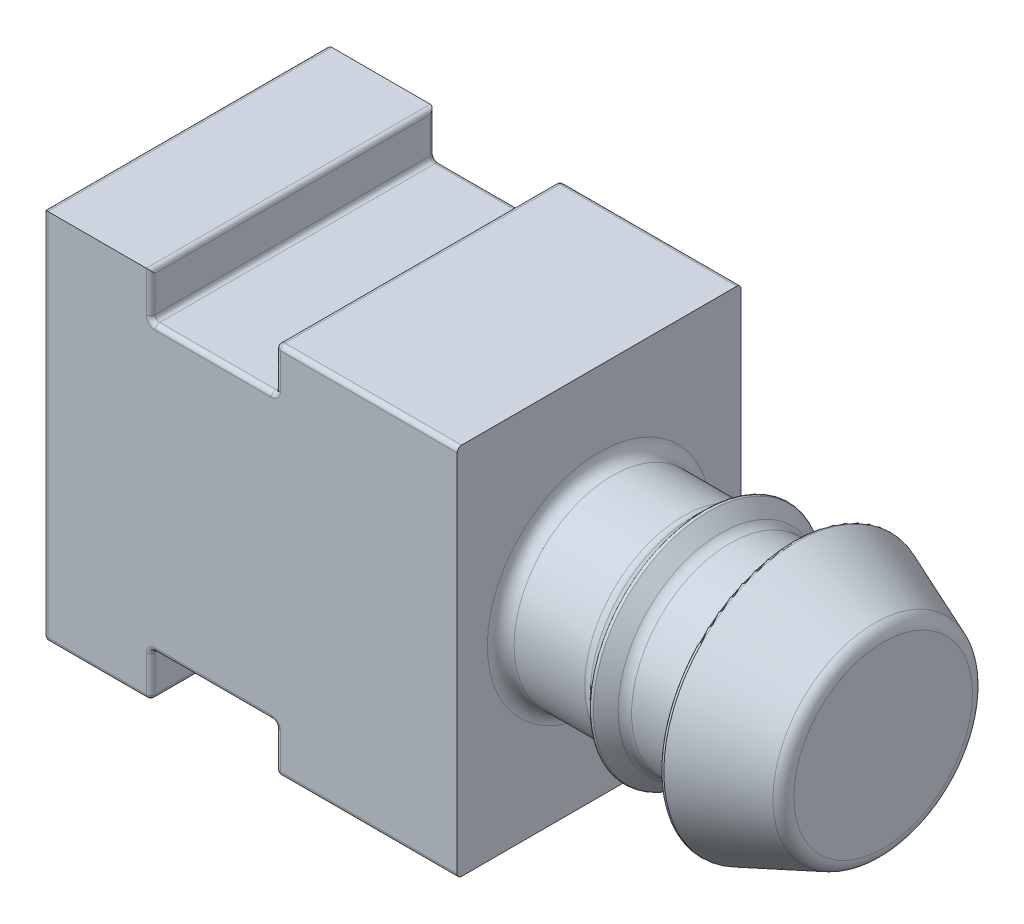
from build123d import *

# Parameters (mm, degrees)
SKETCH2_W           = 18.5
SKETCH2_H           = 12.7
SKETCH2_R           = 3.175
BOSS_EXTRUDE2_DEPTH = 6.35
SKETCH12_R          = 3.175
BOSS_EXTRUDE3_DEPTH = 12.7
SKETCH13_W          = 18.5
SKETCH13_H          = 12.7
BOSS_EXTRUDE4_DEPTH = 2
SKETCH15_W          = 5.6
SKETCH15_H          = 2
CUT_EXTRUDE1_DEPTH  = 24.942900827
FILLET1_R           = 0.1
FILLET2_R           = 0.6
FILLET5_R           = 0.2


with BuildPart() as part:
    # Sketch2 → Boss-Extrude2 (new, symmetric)
    with BuildSketch(Plane(origin=(0, 0, 0), x_dir=(1, 0, 0), z_dir=(0, 1, 0))):
        with Locations((-9.25, 0)):
            Rectangle(SKETCH2_W, SKETCH2_H)
        with Locations(Location((-12.7, 0, 0), (0, 0, 270))):
            Circle(SKETCH2_R, mode=Mode.SUBTRACT)
    extrude(amount=BOSS_EXTRUDE2_DEPTH, both=True)

    # Sketch3 → Revolve1 (revolve)
    with BuildSketch(Plane.XY):
        Polygon((0, 0), (0, 4.4), (4, 4.4), (4.8, 5.2), (5.6, 4.4), (8.7, 4.4), (8.7, 6), (12.7, 4.4), (12.7, 0), align=None)
    revolve(axis=Axis((12.7, 0, 0), (-1, 0, 0)))

    # Sketch12 → Boss-Extrude3 (add)
    with BuildSketch(Plane.XZ.offset(6.35)):
        with Locations((-12.7, 0)):
            Circle(SKETCH12_R)
    extrude(amount=-BOSS_EXTRUDE3_DEPTH)

    # Sketch13 → Boss-Extrude4 (add)
    with BuildSketch(Plane.XZ.offset(6.35)):
        with Locations((-9.25, 0)):
            Rectangle(SKETCH13_W, SKETCH13_H)
    boss_extrude4 = extrude(amount=BOSS_EXTRUDE4_DEPTH)

    # Mirror1: Boss-Extrude4 across plane
    add(boss_extrude4.mirror(Plane.ZX))

    # Sketch15 → Cut-Extrude1 (cut, through all)
    with BuildSketch(Plane(origin=(0, 0, -6.35), x_dir=(-1, 0, 0), z_dir=(0, 0, -1))):
        with Locations((10.9, 7.35)):
            Rectangle(SKETCH15_W, SKETCH15_H)
        with Locations((10.9, -7.35)):
            Rectangle(SKETCH15_W, SKETCH15_H)
    extrude(amount=-CUT_EXTRUDE1_DEPTH, mode=Mode.SUBTRACT)

    # Fillet1
    fillet1_edges = [part.edges().sort_by_distance(p)[0] for p in [
        (8.7, -6, 0),
        (4.8, -5.2, 0),
    ]]
    fillet(fillet1_edges, radius=FILLET1_R)

    # Fillet2
    fillet2_edges = [part.edges().sort_by_distance(p)[0] for p in [
        (0, -4.4, 0),
        (5.6, -4.4, 0),
        (8.7, -4.4, 0),
        (12.7, -4.4, 0),
        (4, -4.4, 0),
    ]]
    fillet(fillet2_edges, radius=FILLET2_R)

    # Fillet5
    fillet5_edges = [part.edges().sort_by_distance(p)[0] for p in [
        (-4.05, -8.35, 6.35),
        (-18.5, -8.35, 0),
        (-16.1, -8.35, -6.35),
        (-18.5, 8.35, 0),
        (-4.05, 8.35, 6.35),
        (-4.05, 8.35, -6.35),
        (-16.1, -8.35, 6.35),
        (-4.05, -8.35, -6.35),
        (-8.1, 7.35, 6.35),
        (-8.1, 6.35, 0),
        (-8.1, 8.35, 0),
        (-13.7, 7.35, 6.35),
        (-13.7, 8.35, 0),
        (-10.9, 6.35, 6.35),
        (-13.7, 6.35, 0),
        (-8.1, 7.35, -6.35),
        (-10.9, 6.35, -6.35),
        (-13.7, 7.35, -6.35),
        (-13.7, -8.35, 0),
        (-8.1, -7.35, 6.35),
        (-8.1, -8.35, 0),
        (-10.9, -6.35, 6.35),
        (-8.1, -6.35, 0),
        (-13.7, -7.35, 6.35),
        (-13.7, -6.35, 0),
        (-13.7, -7.35, -6.35),
        (-10.9, -6.35, -6.35),
        (-8.1, -7.35, -6.35),
        (-18.5, 0, 6.35),
        (-18.5, 0, -6.35),
    ]]
    fillet(fillet5_edges, radius=FILLET5_R)


solid = part.part
